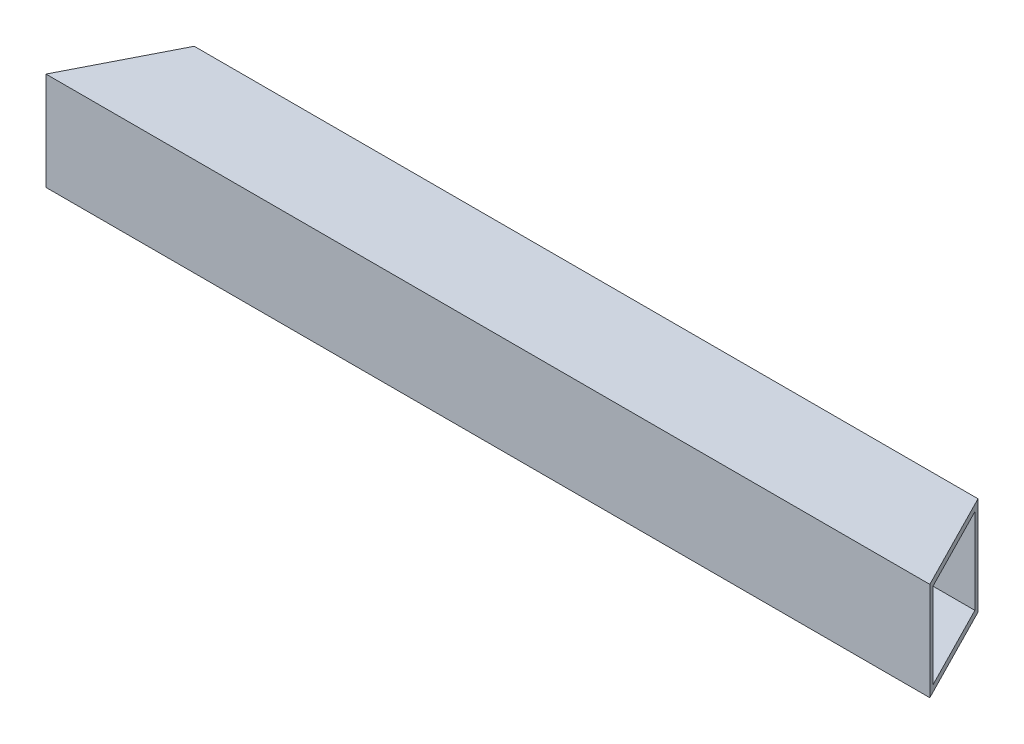
from build123d import *

# Parameters (mm, degrees)
SKETCH1_W           = 25.4
SKETCH1_H           = 25.4
BOSS_EXTRUDE1_DEPTH = 114.3
CUT_EXTRUDE1_DEPTH  = 685.8
SKETCH5_W           = 22.098
SKETCH5_H           = 22.098
CUT_EXTRUDE3_DEPTH  = 230.304470083
CUT_EXTRUDE4_DEPTH  = 685.8


with BuildPart() as part:
    # Sketch1 → Boss-Extrude1 (new, symmetric)
    with BuildSketch(Plane(origin=(0, 0, 0), x_dir=(0, 0, -1), z_dir=(1, 0, 0))):
        Rectangle(SKETCH1_W, SKETCH1_H)
    extrude(amount=BOSS_EXTRUDE1_DEPTH, both=True)

    # Sketch2 → Cut-Extrude1 (cut)
    with BuildSketch(Plane(origin=(0, 12.7, 0), x_dir=(1, 0, 0), z_dir=(0, 1, 0))):
        Polygon((114.3, -12.7), (101.358053583, 12.7), (114.3, 12.7), align=None)
    extrude(amount=-CUT_EXTRUDE1_DEPTH, mode=Mode.SUBTRACT)

    # Sketch5 → Cut-Extrude3 (cut, through all)
    with BuildSketch(Plane.ZY.offset(114.3)):
        Rectangle(SKETCH5_W, SKETCH5_H)
    extrude(amount=-CUT_EXTRUDE3_DEPTH, mode=Mode.SUBTRACT)

    # Sketch6 → Cut-Extrude4 (cut)
    with BuildSketch(Plane(origin=(0, 12.7, 0), x_dir=(1, 0, 0), z_dir=(0, 1, 0))):
        Polygon((-114.3, -12.7), (-101.358053583, 12.7), (-114.3, 12.7), align=None)
    extrude(amount=-CUT_EXTRUDE4_DEPTH, mode=Mode.SUBTRACT)


solid = part.part
